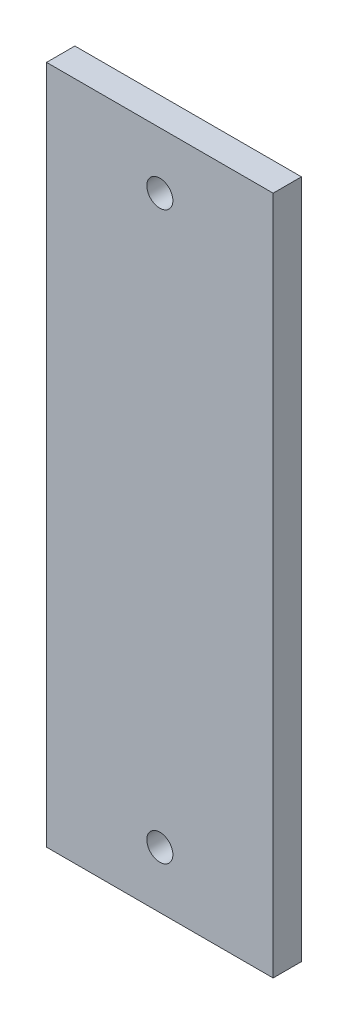
from build123d import *

# Parameters (mm, degrees)
SKETCH2_W           = 25.4
SKETCH2_H           = 76.2
SKETCH2_R           = 1.4605
BOSS_EXTRUDE1_DEPTH = 3.175


with BuildPart() as part:
    # Sketch2 → Boss-Extrude1 (new body)
    with BuildSketch(Plane.XY):
        with Locations((12.7, 38.1)):
            Rectangle(SKETCH2_W, SKETCH2_H)
        with Locations((12.7, 69.85)):
            Circle(SKETCH2_R, mode=Mode.SUBTRACT)
        with Locations((12.7, 6.35)):
            Circle(SKETCH2_R, mode=Mode.SUBTRACT)
    extrude(amount=BOSS_EXTRUDE1_DEPTH)


solid = part.part
